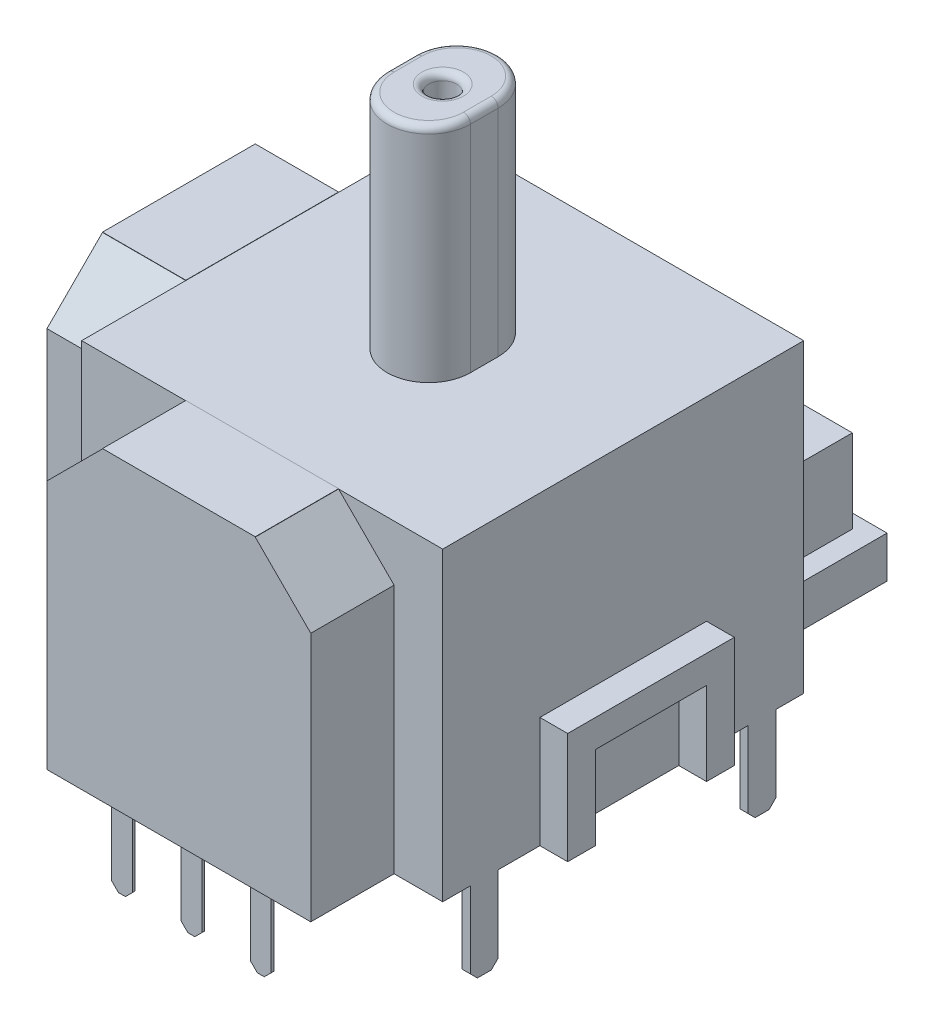
from build123d import *

# Parameters (mm, degrees)
SKETCH2_W           = 13
SKETCH2_H           = 11
BOSS_EXTRUDE1_DEPTH = 6.5
BOSS_EXTRUDE2_DEPTH = 1
SKETCH4_W           = 9.5
SKETCH4_H           = 11
BOSS_EXTRUDE3_DEPTH = 3
CHAMFER1_SIZE       = 2
SKETCH5_W           = 9.5
SKETCH5_H           = 11
BOSS_EXTRUDE4_DEPTH = 3
CHAMFER2_SIZE       = 2
SKETCH6_W           = 9
SKETCH6_H           = 1.5
BOSS_EXTRUDE5_DEPTH = 5
SKETCH7_W           = 7.5
SKETCH7_H           = 3
BOSS_EXTRUDE6_DEPTH = 4.5
SKETCH8_R           = 0.5
BOSS_EXTRUDE7_DEPTH = 8
FILLET2_R           = 0.25
SKETCH9_W           = 3
SKETCH9_H           = 5.5
SKETCH9_W_2         = 5.5
SKETCH9_H_2         = 3
BOSS_EXTRUDE8_DEPTH = 0.01
SKETCH10_W          = 0.3
SKETCH10_H          = 1
SKETCH10_W_2        = 0.1
SKETCH10_H_2        = 0.75
SKETCH10_W_3        = 0.75
SKETCH10_H_3        = 0.1
SKETCH10_W_4        = 0.25
SKETCH10_H_4        = 0.25
BOSS_EXTRUDE9_DEPTH = 3
CHAMFER3_SIZE       = 0.25
CHAMFER4_SIZE       = 0.1


with BuildPart() as part:
    # Sketch2 → Boss-Extrude1 (new, symmetric)
    with BuildSketch(Plane(origin=(0, 0, 0), x_dir=(0, 0, -1), z_dir=(1, 0, 0))):
        Rectangle(SKETCH2_W, SKETCH2_H)
    extrude(amount=BOSS_EXTRUDE1_DEPTH, both=True)

    # Sketch3 → Boss-Extrude2 (add)
    with BuildSketch(Plane(origin=(6.5, 0, 0), x_dir=(0, 0, -1), z_dir=(1, 0, 0))):
        Polygon((3, -1.5), (-3, -1.5), (-3, -5.5), (-2, -5.5), (-2, -2.5), (2, -2.5), (2, -5.5), (3, -5.5), align=None)
    extrude(amount=BOSS_EXTRUDE2_DEPTH)

    # Sketch4 → Boss-Extrude3 (add)
    with BuildSketch(Plane.XY.offset(6.5)):
        Rectangle(SKETCH4_W, SKETCH4_H)
    extrude(amount=BOSS_EXTRUDE3_DEPTH)

    # Chamfer1
    chamfer1_edges = [part.edges().sort_by_distance(p)[0] for p in [
        (-4.75, 5.5, 8),
        (4.75, 5.5, 8),
    ]]
    chamfer(chamfer1_edges, length=CHAMFER1_SIZE)

    # Sketch5 → Boss-Extrude4 (add)
    with BuildSketch(Plane.ZY.offset(6.5)):
        Rectangle(SKETCH5_W, SKETCH5_H)
    extrude(amount=BOSS_EXTRUDE4_DEPTH)

    # Chamfer2
    chamfer2_edges = [part.edges().sort_by_distance(p)[0] for p in [
        (-8, 5.5, -4.75),
        (-8, 5.5, 4.75),
    ]]
    chamfer(chamfer2_edges, length=CHAMFER2_SIZE)

    # Sketch6 → Boss-Extrude5 (add)
    with BuildSketch(Plane(origin=(0, 0, -6.5), x_dir=(-1, 0, 0), z_dir=(0, 0, -1))):
        with Locations((0, -4.75)):
            Rectangle(SKETCH6_W, SKETCH6_H)
    extrude(amount=BOSS_EXTRUDE5_DEPTH)

    # Sketch7 → Boss-Extrude6 (add)
    with BuildSketch(Plane(origin=(0, 0, -6.5), x_dir=(-1, 0, 0), z_dir=(0, 0, -1))):
        with Locations((0, -2.5)):
            Rectangle(SKETCH7_W, SKETCH7_H)
    extrude(amount=BOSS_EXTRUDE6_DEPTH)

    # Sketch8 → Boss-Extrude7 (add)
    with BuildSketch(Plane(origin=(0, 5.5, 0), x_dir=(1, 0, 0), z_dir=(0, 1, 0))):
        with BuildLine():
            Line((1.5, 0.5), (1.5, -0.5))
            ThreePointArc((1.5, -0.5), (0, -2), (-1.5, -0.5))
            Line((-1.5, -0.5), (-1.5, 0.5))
            ThreePointArc((-1.5, 0.5), (0, 2), (1.5, 0.5))
        make_face()
        with Locations(Location((0, 0, 0), (0, 0, 270))):
            Circle(SKETCH8_R, mode=Mode.SUBTRACT)
    extrude(amount=BOSS_EXTRUDE7_DEPTH)

    # Fillet2
    fillet2_edges = [part.edges().sort_by_distance(p)[0] for p in [
        (0, 13.5, -2),
        (-1.5, 13.5, 0),
        (0, 13.5, 2),
        (1.5, 13.5, 0),
        (0, 13.5, -0.5),
    ]]
    fillet(fillet2_edges, radius=FILLET2_R)

    # Sketch9 → Boss-Extrude8 (add)
    with BuildSketch(Plane(origin=(0, 5.5, 0), x_dir=(1, 0, 0), z_dir=(0, 1, 0))):
        with Locations((-8, 0)):
            Rectangle(SKETCH9_W, SKETCH9_H)
        with Locations((0, -8)):
            Rectangle(SKETCH9_W_2, SKETCH9_H_2)
    extrude(amount=BOSS_EXTRUDE8_DEPTH)

    # Sketch10 → Boss-Extrude9 (add)
    with BuildSketch(Plane.XZ.offset(5.5)):
        with Locations((-6.35, -5)):
            Rectangle(SKETCH10_W, SKETCH10_H)
        with Locations((6.35, -5)):
            Rectangle(SKETCH10_W, SKETCH10_H)
        with Locations((-6.35, 5)):
            Rectangle(SKETCH10_W, SKETCH10_H)
        with Locations((6.35, 5)):
            Rectangle(SKETCH10_W, SKETCH10_H)
        with Locations((-9.15, 0)):
            Rectangle(SKETCH10_W_2, SKETCH10_H_2)
        with Locations((-9.15, -2.5)):
            Rectangle(SKETCH10_W_2, SKETCH10_H_2)
        with Locations((-9.15, 2.5)):
            Rectangle(SKETCH10_W_2, SKETCH10_H_2)
        with Locations((0, 9)):
            Rectangle(SKETCH10_W_3, SKETCH10_H_3)
        with Locations((-2.5, 9)):
            Rectangle(SKETCH10_W_3, SKETCH10_H_3)
        with Locations((2.5, 9)):
            Rectangle(SKETCH10_W_3, SKETCH10_H_3)
        with Locations((-3.1, -5.5)):
            Rectangle(SKETCH10_W_4, SKETCH10_H_4)
        with Locations((2.9, -5.5)):
            Rectangle(SKETCH10_W_4, SKETCH10_H_4)
        with Locations((2.9, -9.5)):
            Rectangle(SKETCH10_W_4, SKETCH10_H_4)
        with Locations((-3.1, -9.5)):
            Rectangle(SKETCH10_W_4, SKETCH10_H_4)
    extrude(amount=BOSS_EXTRUDE9_DEPTH)

    # Chamfer3
    chamfer3_edges = [part.edges().sort_by_distance(p)[0] for p in [
        (-6.35, -8.5, -5.5),
        (-6.35, -8.5, -4.5),
        (6.35, -8.5, -4.5),
        (6.35, -8.5, -5.5),
        (-6.35, -8.5, 4.5),
        (-6.35, -8.5, 5.5),
        (6.35, -8.5, 5.5),
        (6.35, -8.5, 4.5),
        (-9.15, -8.5, 0.375),
        (-9.15, -8.5, -0.375),
        (-9.15, -8.5, -2.125),
        (-9.15, -8.5, -2.875),
        (-9.15, -8.5, 2.875),
        (-9.15, -8.5, 2.125),
        (0.375, -8.5, 9),
        (-0.375, -8.5, 9),
        (-2.125, -8.5, 9),
        (-2.875, -8.5, 9),
        (2.875, -8.5, 9),
        (2.125, -8.5, 9),
    ]]
    chamfer(chamfer3_edges, length=CHAMFER3_SIZE)

    # Chamfer4
    chamfer4_edges = [part.edges().sort_by_distance(p)[0] for p in [
        (3.025, -8.5, -5.5),
        (2.9, -8.5, -5.375),
        (2.775, -8.5, -5.5),
        (2.9, -8.5, -5.625),
        (-2.975, -8.5, -5.5),
        (-3.1, -8.5, -5.375),
        (-3.225, -8.5, -5.5),
        (-3.1, -8.5, -5.625),
        (3.025, -8.5, -9.5),
        (2.9, -8.5, -9.375),
        (2.775, -8.5, -9.5),
        (2.9, -8.5, -9.625),
        (-2.975, -8.5, -9.5),
        (-3.1, -8.5, -9.375),
        (-3.225, -8.5, -9.5),
        (-3.1, -8.5, -9.625),
    ]]
    chamfer(chamfer4_edges, length=CHAMFER4_SIZE)


solid = part.part
